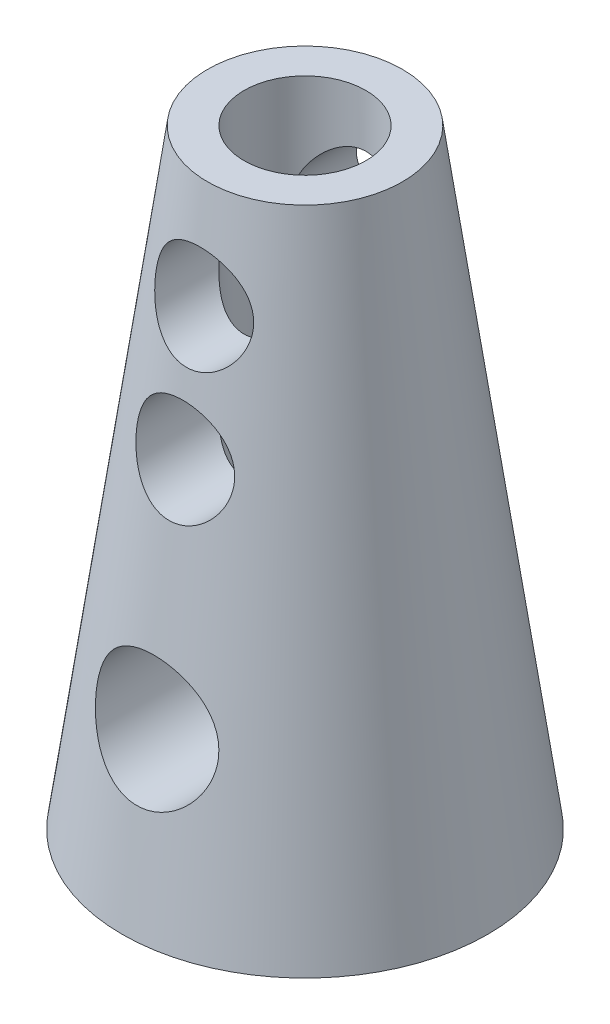
from build123d import *

# Parameters (mm, degrees)
ENL_V_MAT_EXTRU_1_REACH             = 35.324
ESQUISSE2_R                         = 4
ESQUISSE2_R_2                       = 5
ENL_V_MAT_EXTRU_1_DIRECTION_2_REACH = 35.324


with BuildPart() as part:
    # Esquisse1 → Révolution1 (revolve)
    with BuildSketch(Plane.XY, mode=Mode.PRIVATE) as r_volution1_sk:
        Polygon((5, 25.69935248), (5, -24.30064752), (15, -24.30064752), (8, 25.69935248), align=None)
    revolve(r_volution1_sk.sketch.rotate(Axis((0, -24.30064752, 0), (0, 1, 0)), 90), axis=Axis((0, -24.30064752, 0), (0, 1, 0)))

    # Enlèv. mat.-Extru.1: up to this cone (the profile starts inside it)
    enl_v_mat_extru_1_end = Plane(origin=(0, 3.3146925, 0), z_dir=(0, -1, 0)) * Cone(2.591937212, 19.675767583, 122.027359794, mode=Mode.PRIVATE)
    # Esquisse2 → Enlèv. mat.-Extru.1 (cut, up to the surface)
    with BuildSketch(Plane.XY, mode=Mode.PRIVATE) as enl_v_mat_extru_1_sk1:
        with Locations((0, 17.370519831)):
            Circle(ESQUISSE2_R)
    enl_v_mat_extru_1_tool1 = extrude(enl_v_mat_extru_1_sk1.sketch, amount=-ENL_V_MAT_EXTRU_1_REACH, mode=Mode.PRIVATE) & enl_v_mat_extru_1_end
    add(enl_v_mat_extru_1_tool1.solids().sort_by_distance((0, 17.37052, 0))[0], mode=Mode.SUBTRACT)
    # Esquisse2 → Enlèv. mat.-Extru.1 (cut, up to the surface)
    with BuildSketch(Plane.XY, mode=Mode.PRIVATE) as enl_v_mat_extru_1_sk2:
        with Locations((0, 7.196993588)):
            Circle(ESQUISSE2_R)
    enl_v_mat_extru_1_tool2 = extrude(enl_v_mat_extru_1_sk2.sketch, amount=-ENL_V_MAT_EXTRU_1_REACH, mode=Mode.PRIVATE) & enl_v_mat_extru_1_end
    add(enl_v_mat_extru_1_tool2.solids().sort_by_distance((0, 7.196994, 0))[0], mode=Mode.SUBTRACT)
    # Esquisse2 → Enlèv. mat.-Extru.1 (cut, up to the surface)
    with BuildSketch(Plane.XY, mode=Mode.PRIVATE) as enl_v_mat_extru_1_sk3:
        with Locations((0, -10.741135407)):
            Circle(ESQUISSE2_R_2)
    enl_v_mat_extru_1_tool3 = extrude(enl_v_mat_extru_1_sk3.sketch, amount=-ENL_V_MAT_EXTRU_1_REACH, mode=Mode.PRIVATE) & enl_v_mat_extru_1_end
    add(enl_v_mat_extru_1_tool3.solids().sort_by_distance((0, -10.741135, 0))[0], mode=Mode.SUBTRACT)

    # Enlèv. mat.-Extru.1 direction 2: up to this cone (the profile starts inside it)
    enl_v_mat_extru_1_direction_2_end = Plane(origin=(0, 3.3146925, 0), z_dir=(0, -1, 0)) * Cone(2.591937212, 19.675767583, 122.027359794, mode=Mode.PRIVATE)
    # Esquisse2 → Enlèv. mat.-Extru.1 direction 2 (cut, up to the surface)
    with BuildSketch(Plane.XY, mode=Mode.PRIVATE) as enl_v_mat_extru_1_direction_2_sk1:
        with Locations((0, 17.370519831)):
            Circle(ESQUISSE2_R)
    enl_v_mat_extru_1_direction_2_tool1 = extrude(enl_v_mat_extru_1_direction_2_sk1.sketch, amount=ENL_V_MAT_EXTRU_1_DIRECTION_2_REACH, mode=Mode.PRIVATE) & enl_v_mat_extru_1_direction_2_end
    add(enl_v_mat_extru_1_direction_2_tool1.solids().sort_by_distance((0, 17.37052, 0))[0], mode=Mode.SUBTRACT)
    # Esquisse2 → Enlèv. mat.-Extru.1 direction 2 (cut, up to the surface)
    with BuildSketch(Plane.XY, mode=Mode.PRIVATE) as enl_v_mat_extru_1_direction_2_sk2:
        with Locations((0, 7.196993588)):
            Circle(ESQUISSE2_R)
    enl_v_mat_extru_1_direction_2_tool2 = extrude(enl_v_mat_extru_1_direction_2_sk2.sketch, amount=ENL_V_MAT_EXTRU_1_DIRECTION_2_REACH, mode=Mode.PRIVATE) & enl_v_mat_extru_1_direction_2_end
    add(enl_v_mat_extru_1_direction_2_tool2.solids().sort_by_distance((0, 7.196994, 0))[0], mode=Mode.SUBTRACT)
    # Esquisse2 → Enlèv. mat.-Extru.1 direction 2 (cut, up to the surface)
    with BuildSketch(Plane.XY, mode=Mode.PRIVATE) as enl_v_mat_extru_1_direction_2_sk3:
        with Locations((0, -10.741135407)):
            Circle(ESQUISSE2_R_2)
    enl_v_mat_extru_1_direction_2_tool3 = extrude(enl_v_mat_extru_1_direction_2_sk3.sketch, amount=ENL_V_MAT_EXTRU_1_DIRECTION_2_REACH, mode=Mode.PRIVATE) & enl_v_mat_extru_1_direction_2_end
    add(enl_v_mat_extru_1_direction_2_tool3.solids().sort_by_distance((0, -10.741135, 0))[0], mode=Mode.SUBTRACT)


solid = part.part
